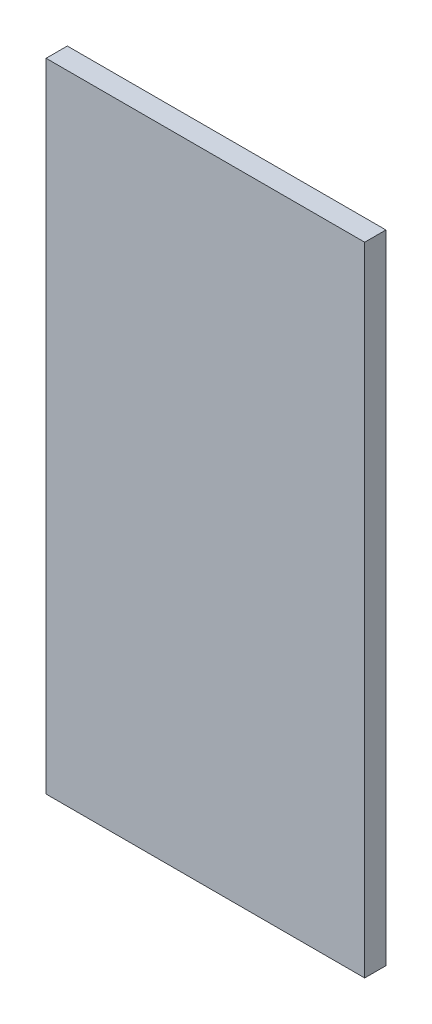
from build123d import *

# Parameters (mm, degrees)
CROQUIS1_W              = 150
CROQUIS1_H              = 300
SALIENTE_EXTRUIR1_DEPTH = 10


with BuildPart() as part:
    # Croquis1 → Saliente-Extruir1 (new body)
    with BuildSketch(Plane(origin=(0, 0, 360), x_dir=(-1, 0, 0), z_dir=(0, 0, -1))):
        with Locations((7.754092983, 17.834413862)):
            Rectangle(CROQUIS1_W, CROQUIS1_H)
    extrude(amount=SALIENTE_EXTRUIR1_DEPTH)


solid = part.part
